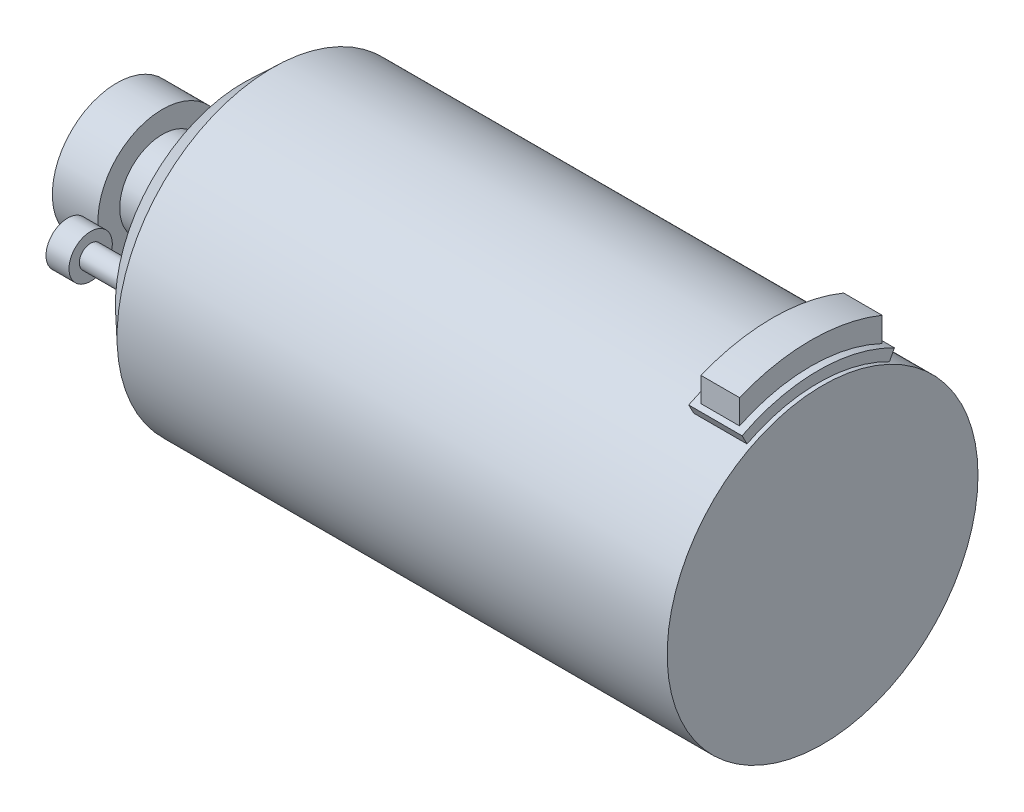
from build123d import *

# Parameters (mm, degrees)
BOSS_EXTRUDE1_DEPTH = 3.429
BOSS_EXTRUDE2_DEPTH = 2.4765
SKETCH7_R           = 1.4605
BOSS_EXTRUDE5_DEPTH = 6.9088
SKETCH8_R           = 2.7813
BOSS_EXTRUDE6_DEPTH = 2.9591


with BuildPart() as part:
    # Sketch1 → Revolve1 (revolve)
    with BuildSketch(Plane.XY, mode=Mode.PRIVATE) as revolve1_sk:
        Polygon((94.6404, 0), (94.6404, 19.9771), (23.9268, 19.9771), (20.1676, 16.42566681), (20.1676, 2.5146), (17.907, 2.5146), (17.907, 5.4864), (9.779, 5.4864), (9.779, 8.2804), (3.9116, 8.2804), (3.9116, 2.5146), (0, 2.5146), (0, 0), align=None)
    revolve(revolve1_sk.sketch.rotate(Axis((94.6404, 0, 0), (-1, 0, 0)), 90), axis=Axis((94.6404, 0, 0), (-1, 0, 0)))

    # Sketch3 → Boss-Extrude1 (add, symmetric)
    with BuildSketch(Plane(origin=(90.6526, 0, 0), x_dir=(0, 0, -1), z_dir=(1, 0, 0))):
        with BuildLine():
            Line((-9.7917, 18.985047302), (-9.157160583, 17.754743999))
            ThreePointArc((-9.157160583, 17.754743999), (0, -19.9771), (9.157160583, 17.754743999))
            Line((9.157160583, 17.754743999), (9.7917, 18.985047302))
            ThreePointArc((9.7917, 18.985047302), (0, 21.3614), (-9.7917, 18.985047302))
        make_face()
    extrude(amount=BOSS_EXTRUDE1_DEPTH, both=True)

    # Sketch4 → Boss-Extrude2 (add, symmetric)
    with BuildSketch(Plane(origin=(90.6526, 0, 0), x_dir=(0, 0, -1), z_dir=(1, 0, 0))):
        with BuildLine():
            Line((-9.1694, 19.293302299), (-9.1694, 22.442902299))
            ThreePointArc((-9.1694, 22.442902299), (0, 24.243798381), (9.1694, 22.442902299))
            Line((9.1694, 22.442902299), (9.1694, 19.293302299))
            ThreePointArc((9.1694, 19.293302299), (9.48180276, 19.141703852), (9.7917, 18.985047302))
            Line((9.7917, 18.985047302), (9.157160583, 17.754743999))
            ThreePointArc((9.157160583, 17.754743999), (0, 19.9771), (-9.157160583, 17.754743999))
            Line((-9.157160583, 17.754743999), (-9.7917, 18.985047302))
            ThreePointArc((-9.7917, 18.985047302), (-9.48180276, 19.141703852), (-9.1694, 19.293302299))
        make_face()
    extrude(amount=BOSS_EXTRUDE2_DEPTH, both=True)

    # Sketch7 → Boss-Extrude5 (add)
    with BuildSketch(Plane.ZY.offset(-20.1676)):
        with Locations((-12.7, 0)):
            Circle(SKETCH7_R)
        with Locations((12.7, 0)):
            Circle(SKETCH7_R)
    extrude(amount=BOSS_EXTRUDE5_DEPTH)

    # Sketch8 → Boss-Extrude6 (add)
    with BuildSketch(Plane.ZY.offset(-13.2588)):
        with Locations((12.7, 0)):
            Circle(SKETCH8_R)
        with Locations((-12.7, 0)):
            Circle(SKETCH8_R)
    extrude(amount=BOSS_EXTRUDE6_DEPTH)


solid = part.part
